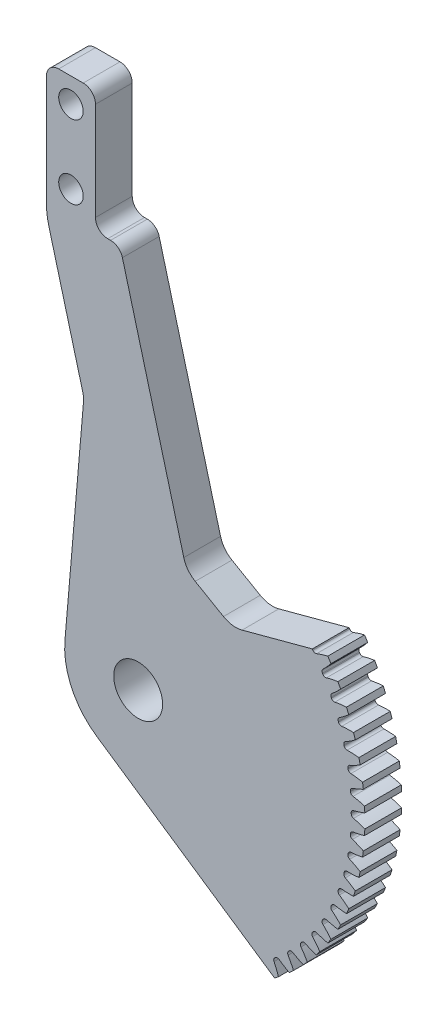
from build123d import *

# Parameters (mm, degrees)
SKETCH2_R                   = 60.325
BOSS_EXTRUDE2_DEPTH         = 4.7625
BOSS_EXTRUDE3_DEPTH         = 9.525
SKETCH4_W                   = 19.05
SKETCH4_H                   = 31.75
BOSS_EXTRUDE4_DEPTH         = 9.525
BOSS_EXTRUDE5_DEPTH         = 9.525
F_1_2_0_5_DIAMETER_HOLE1_D  = 12.6746
CUT_EXTRUDE1_DEPTH          = 143.813025258
CUT_EXTRUDE2_DEPTH          = 143.813025258
CUT_EXTRUDE3_DEPTH          = 12.7
SKETCH15_W                  = 6.35
SKETCH15_H                  = 31.75
CUT_EXTRUDE6_DEPTH          = 143.138284543
F_1_4_0_25_DIAMETER_HOLE1_D = 6.35
FILLET1_R                   = 6.35
FILLET3_R                   = 3.175
CUT_EXTRUDE4_DEPTH          = 1.5875
CUT_EXTRUDE5_DEPTH          = 1.5875
FILLET2_R                   = 0.79375


with BuildPart() as part:
    # Sketch2 → Boss-Extrude2 (new, symmetric)
    with BuildSketch(Plane.XY):
        with Locations(Location((0, 0, 0), (0, 0, 180))):
            Circle(SKETCH2_R)
    extrude(amount=BOSS_EXTRUDE2_DEPTH, both=True)

    # Sketch3 → Boss-Extrude3 (add)
    with BuildSketch(Plane.XY.offset(4.7625)):
        with BuildLine():
            Line((-14.074444457, 58.660170799), (-23.119106797, 92.415310188))
            Line((-23.119106797, 92.415310188), (-4.718219806, 97.345812997))
            Line((-4.718219806, 97.345812997), (5.263113853, 60.094968654))
            ThreePointArc((5.263113853, 60.094968654), (-4.463692191, 60.159629961), (-14.074444457, 58.660170799))
        make_face()
    extrude(amount=-BOSS_EXTRUDE3_DEPTH)



with BuildPart() as body_2:
    # Sketch4 → Boss-Extrude4 (new body)
    with BuildSketch(Plane.XY.offset(4.7625)):
        with Locations((-14.243219806, 113.220812997)):
            Rectangle(SKETCH4_W, SKETCH4_H)
    extrude(amount=-BOSS_EXTRUDE4_DEPTH)


with BuildPart() as part_1:
    add(part.part)

    add(body_2.part)  # Boss-Extrude5 merges body 2
    # Sketch5 → Boss-Extrude5 (add)
    with BuildSketch(Plane.XY.offset(4.7625)):
        with BuildLine():
            Line((-23.768219806, 97.345812997), (-4.718219806, 97.345812997))
            Line((-4.718219806, 97.345812997), (-23.119106797, 92.415310188))
            ThreePointArc((-23.119106797, 92.415310188), (-23.605244415, 94.859289036), (-23.768219806, 97.345812997))
        make_face()
    extrude(amount=-BOSS_EXTRUDE5_DEPTH)

    # 1/2 (0.5) Diameter Hole1 (through all)
    with Locations(Plane.XY.offset(4.7625)):
        with Locations((0, 0)):
            Hole(F_1_2_0_5_DIAMETER_HOLE1_D / 2)

    # Sketch8 → Cut-Extrude1 (cut, through all)
    with BuildSketch(Plane.XY.offset(4.7625)):
        with BuildLine():
            Line((24.377047427, 26.253821409), (50.357281824, 33.215204234))
            ThreePointArc((50.357281824, 33.215204234), (30.88749808, 51.817642627), (5.263113853, 60.094968654))
            Line((5.263113853, 60.094968654), (12.492235056, 33.11552103))
            Line((12.492235056, 33.11552103), (24.377047427, 26.253821409))
        make_face()
    extrude(amount=-CUT_EXTRUDE1_DEPTH, mode=Mode.SUBTRACT)

    # Sketch9 → Cut-Extrude2 (cut, through all)
    with BuildSketch(Plane.XY.offset(4.7625)):
        with BuildLine():
            Line((-14.074444457, 58.660170799), (-18.979910276, 1.632637712))
            ThreePointArc((-18.979910276, 1.632637712), (-17.194819156, -8.200042328), (-10.677837987, -15.776129941))
            Line((-10.677837987, -15.776129941), (36.723533205, -47.859040253))
            ThreePointArc((36.723533205, -47.859040253), (-54.450260661, -25.966800706), (-14.074444457, 58.660170799))
        make_face()
    extrude(amount=-CUT_EXTRUDE2_DEPTH, mode=Mode.SUBTRACT)

    # Sketch10 → Cut-Extrude3 (cut)
    with BuildSketch(Plane.XY.offset(4.7625)):
        with BuildLine():
            Line((23.419033769, -49.979481499), (23.233039333, -50.066212129))
            ThreePointArc((23.233039333, -50.066212129), (22.859764861, -50.426162423), (22.788401381, -50.939782223))
            ThreePointArc((22.788401381, -50.939782223), (23.033501885, -52.449235123), (23.176311309, -53.971775034))
            ThreePointArc((23.176311309, -53.971775034), (22.477868108, -54.266374041), (21.775681229, -54.551935009))
            ThreePointArc((21.775681229, -54.551935009), (20.800064445, -53.374355201), (19.906032292, -52.133698591))
            ThreePointArc((19.906032292, -52.133698591), (19.492386647, -51.820976148), (18.973918443, -51.830397765))
            Line((18.973918443, -51.830397765), (18.781072699, -51.900587876))
            ThreePointArc((18.781072699, -51.900587876), (18.377846913, -52.226635436), (18.261990078, -52.732081021))
            ThreePointArc((18.261990078, -52.732081021), (18.374600412, -54.257151913), (18.384168307, -55.786344762))
            ThreePointArc((18.384168307, -55.786344762), (17.662706898, -56.018949394), (16.938303774, -56.242224098))
            ThreePointArc((16.938303774, -56.242224098), (16.069032349, -54.984094731), (15.286532607, -53.670239159))
            ThreePointArc((15.286532607, -53.670239159), (14.901716566, -53.322655125), (14.384400142, -53.286853409))
            Line((14.384400142, -53.286853409), (14.186170762, -53.339968811))
            ThreePointArc((14.186170762, -53.339968811), (13.756062455, -53.629632219), (13.596594005, -54.123056843))
            ThreePointArc((13.596594005, -54.123056843), (13.575857136, -55.652139017), (13.452110683, -57.176346722))
            Line((13.452110683, -57.176346722), (12.713121824, -57.345186719))
            Line((12.713121824, -57.345186719), (13.743915485, -61.994796452))
            ThreePointArc((13.743915485, -61.994796452), (60.561026372, -19.094818269), (46.817110887, 42.899978184))
            Line((46.817110887, 42.899978184), (43.30582757, 39.68247982))
            Line((43.30582757, 39.68247982), (43.814329162, 39.120307595))
            ThreePointArc((43.814329162, 39.120307595), (43.041446698, 37.800771687), (42.181387842, 36.536326718))
            ThreePointArc((42.181387842, 36.536326718), (42.029000012, 36.040669584), (42.215180006, 35.556691222))
            Line((42.215180006, 35.556691222), (42.347094264, 35.399481931))
            ThreePointArc((42.347094264, 35.399481931), (42.791390091, 35.132088469), (43.305978949, 35.196091227))
            ThreePointArc((43.305978949, 35.196091227), (44.70056181, 35.823515292), (46.134260634, 36.355520928))
            ThreePointArc((46.134260634, 36.355520928), (46.599591824, 35.757124437), (47.057161875, 35.152772613))
            ThreePointArc((47.057161875, 35.152772613), (46.172215331, 33.905619084), (45.205225619, 32.720944779))
            ThreePointArc((45.205225619, 32.720944779), (45.010218305, 32.240455244), (45.153508334, 31.742091909))
            Line((45.153508334, 31.742091909), (45.271218927, 31.573983761))
            ThreePointArc((45.271218927, 31.573983761), (45.690519198, 31.268884879), (46.208728098, 31.287794713))
            ThreePointArc((46.208728098, 31.287794713), (47.65268776, 31.791285335), (49.127298273, 32.196311443))
            ThreePointArc((49.127298273, 32.196311443), (49.538705047, 31.559635745), (49.941861175, 30.917703804))
            ThreePointArc((49.941861175, 30.917703804), (48.951585527, 29.752424244), (47.885024334, 28.656536689))
            ThreePointArc((47.885024334, 28.656536689), (47.648881659, 28.19487157), (47.7481912, 27.685916109))
            Line((47.7481912, 27.685916109), (47.850802277, 27.508188511))
            ThreePointArc((47.850802277, 27.508188511), (48.241915865, 27.167706196), (48.759800924, 27.141379191))
            ThreePointArc((48.759800924, 27.141379191), (50.242147983, 27.517104501), (51.746447509, 27.792068588))
            ThreePointArc((51.746447509, 27.792068588), (52.100798813, 27.12195917), (52.446472754, 26.447332603))
            ThreePointArc((52.446472754, 26.447332603), (51.358404599, 25.372795493), (50.200389099, 24.374035054))
            ThreePointArc((50.200389099, 24.374035054), (49.924908252, 23.934707899), (49.979481499, 23.419033771))
            Line((49.979481499, 23.419033771), (50.066212129, 23.233039335))
            ThreePointArc((50.066212129, 23.233039335), (50.426162422, 22.859764862), (50.939782223, 22.788401383))
            ThreePointArc((50.939782223, 22.788401383), (52.449235122, 23.033501886), (53.971775034, 23.176311309))
            ThreePointArc((53.971775034, 23.176311309), (54.266374041, 22.477868108), (54.551935009, 21.775681229))
            ThreePointArc((54.551935009, 21.775681229), (53.374355201, 20.800064445), (52.133698591, 19.906032292))
            ThreePointArc((52.133698591, 19.906032292), (51.820976148, 19.492386648), (51.830397765, 18.973918444))
            Line((51.830397765, 18.973918444), (51.900587876, 18.781072699))
            ThreePointArc((51.900587876, 18.781072699), (52.226635436, 18.377846913), (52.732081021, 18.261990078))
            ThreePointArc((52.732081021, 18.261990078), (54.257151913, 18.374600412), (55.786344761, 18.384168307))
            ThreePointArc((55.786344761, 18.384168307), (56.018949394, 17.662706898), (56.242224097, 16.938303774))
            ThreePointArc((56.242224097, 16.938303774), (54.984094731, 16.069032349), (53.670239158, 15.286532607))
            ThreePointArc((53.670239158, 15.286532607), (53.322655125, 14.901716566), (53.286853409, 14.384400142))
            Line((53.286853409, 14.384400142), (53.339968811, 14.186170762))
            ThreePointArc((53.339968811, 14.186170762), (53.629632219, 13.756062455), (54.123056842, 13.596594005))
            ThreePointArc((54.123056842, 13.596594005), (55.652139016, 13.575857136), (57.176346722, 13.452110683))
            ThreePointArc((57.176346722, 13.452110683), (57.345186718, 12.713121824), (57.504475902, 11.9720156))
            ThreePointArc((57.504475902, 11.9720156), (56.1753721, 11.215705215), (54.798316797, 10.550693178))
            ThreePointArc((54.798316797, 10.550693178), (54.418516498, 10.197635423), (54.337763921, 9.685407869))
            Line((54.337763921, 9.685407869), (54.373400374, 9.483303501))
            ThreePointArc((54.373400374, 9.483303501), (54.624475117, 9.029586056), (55.102123519, 8.827719642))
            ThreePointArc((55.102123519, 8.827719642), (56.623579737, 8.67379339), (58.131202157, 8.417674375))
            ThreePointArc((58.131202157, 8.417674375), (58.234992544, 7.666782215), (58.32908392, 6.914613157))
            ThreePointArc((58.32908392, 6.914613157), (56.939120968, 6.27701979), (55.50934616, 5.734556603))
            ThreePointArc((55.50934616, 5.734556603), (55.100220105, 5.415944117), (54.975131243, 4.912703794))
            Line((54.975131243, 4.912703794), (54.993017532, 4.708262572))
            ThreePointArc((54.993017532, 4.708262572), (55.203592778, 4.234389054), (55.661829767, 3.991661001))
            ThreePointArc((55.661829767, 3.991661001), (57.164080827, 3.705716838), (58.643644045, 3.319174481))
            ThreePointArc((58.643644045, 3.319174481), (58.681594914, 2.562093766), (58.709772392, 1.804586335))
            ThreePointArc((58.709772392, 1.804586335), (57.269528744, 1.290562457), (55.797915879, 0.874776591))
            ThreePointArc((55.797915879, 0.874776591), (55.362577764, 0.593034207), (55.194104619, 0.102611078))
            Line((55.194104619, 0.102611078), (55.194104619, -0.102611077))
            ThreePointArc((55.194104619, -0.102611077), (55.362577764, -0.593034206), (55.797915879, -0.87477659))
            ThreePointArc((55.797915879, -0.87477659), (57.269528744, -1.290562456), (58.709772391, -1.804586334))
            ThreePointArc((58.709772391, -1.804586334), (58.681594914, -2.562093766), (58.643644045, -3.319174482))
            ThreePointArc((58.643644045, -3.319174482), (57.164080827, -3.705716839), (55.661829767, -3.991661001))
            ThreePointArc((55.661829767, -3.991661001), (55.203592778, -4.234389054), (54.993017532, -4.708262572))
            Line((54.993017532, -4.708262572), (54.975131243, -4.912703796))
            ThreePointArc((54.975131243, -4.912703796), (55.100220104, -5.415944117), (55.509346158, -5.734556604))
            ThreePointArc((55.509346158, -5.734556604), (56.939120967, -6.277019791), (58.329083921, -6.914613157))
            ThreePointArc((58.329083921, -6.914613157), (58.234992544, -7.666782215), (58.131202157, -8.417674373))
            ThreePointArc((58.131202157, -8.417674373), (56.623579737, -8.673793389), (55.10212352, -8.82771964))
            ThreePointArc((55.10212352, -8.82771964), (54.624475118, -9.029586055), (54.373400376, -9.483303499))
            Line((54.373400376, -9.483303499), (54.337763922, -9.685407871))
            ThreePointArc((54.337763922, -9.685407871), (54.418516499, -10.197635424), (54.798316797, -10.550693179))
            ThreePointArc((54.798316797, -10.550693179), (56.175372099, -11.215705215), (57.504475901, -11.9720156))
            ThreePointArc((57.504475901, -11.9720156), (57.345186717, -12.713121823), (57.176346721, -13.452110683))
            ThreePointArc((57.176346721, -13.452110683), (55.652139016, -13.575857136), (54.123056842, -13.596594005))
            ThreePointArc((54.123056842, -13.596594005), (53.629632219, -13.756062456), (53.339968811, -14.186170763))
            Line((53.339968811, -14.186170763), (53.286853409, -14.384400143))
            ThreePointArc((53.286853409, -14.384400143), (53.322655125, -14.901716567), (53.670239157, -15.286532608))
            ThreePointArc((53.670239157, -15.286532608), (54.98409473, -16.06903235), (56.242224097, -16.938303774))
            ThreePointArc((56.242224097, -16.938303774), (56.018949394, -17.662706898), (55.786344761, -18.384168307))
            ThreePointArc((55.786344761, -18.384168307), (54.257151913, -18.374600413), (52.732081021, -18.261990079))
            ThreePointArc((52.732081021, -18.261990079), (52.226635436, -18.377846914), (51.900587876, -18.7810727))
            Line((51.900587876, -18.7810727), (51.830397765, -18.973918446))
            ThreePointArc((51.830397765, -18.973918446), (51.820976147, -19.49238665), (52.133698591, -19.906032294))
            ThreePointArc((52.133698591, -19.906032294), (53.3743552, -20.800064446), (54.551935009, -21.77568123))
            ThreePointArc((54.551935009, -21.77568123), (54.26637404, -22.477868109), (53.971775034, -23.17631131))
            ThreePointArc((53.971775034, -23.17631131), (52.449235122, -23.033501886), (50.939782222, -22.788401382))
            ThreePointArc((50.939782222, -22.788401382), (50.426162422, -22.859764862), (50.066212128, -23.233039334))
            Line((50.066212128, -23.233039334), (49.979481498, -23.419033771))
            ThreePointArc((49.979481498, -23.419033771), (49.924908251, -23.934707899), (50.200389098, -24.374035054))
            ThreePointArc((50.200389098, -24.374035054), (51.358404598, -25.372795492), (52.446472755, -26.447332602))
            ThreePointArc((52.446472755, -26.447332602), (52.100798813, -27.12195917), (51.746447509, -27.792068588))
            ThreePointArc((51.746447509, -27.792068588), (50.242147983, -27.5171045), (48.759800924, -27.141379189))
            ThreePointArc((48.759800924, -27.141379189), (48.241915865, -27.167706193), (47.850802277, -27.508188509))
            Line((47.850802277, -27.508188509), (47.748191198, -27.685916109))
            ThreePointArc((47.748191198, -27.685916109), (47.648881658, -28.19487157), (47.885024332, -28.65653669))
            ThreePointArc((47.885024332, -28.65653669), (48.951585526, -29.752424244), (49.941861175, -30.917703804))
            ThreePointArc((49.941861175, -30.917703804), (49.538705047, -31.559635745), (49.127298272, -32.196311444))
            ThreePointArc((49.127298272, -32.196311444), (47.652687759, -31.791285335), (46.208728097, -31.287794714))
            ThreePointArc((46.208728097, -31.287794714), (45.690519197, -31.268884879), (45.271218925, -31.573983761))
            Line((45.271218925, -31.573983761), (45.153508334, -31.742091908))
            ThreePointArc((45.153508334, -31.742091908), (45.010218305, -32.240455243), (45.205225619, -32.720944778))
            ThreePointArc((45.205225619, -32.720944778), (46.172215331, -33.905619083), (47.057161876, -35.152772612))
            ThreePointArc((47.057161876, -35.152772612), (46.599591825, -35.757124436), (46.134260634, -36.355520928))
            ThreePointArc((46.134260634, -36.355520928), (44.700561811, -35.823515291), (43.30597895, -35.196091226))
            ThreePointArc((43.30597895, -35.196091226), (42.791390092, -35.132088468), (42.347094265, -35.39948193))
            Line((42.347094265, -35.39948193), (42.215180006, -35.556691222))
            ThreePointArc((42.215180006, -35.556691222), (42.029000012, -36.040669585), (42.181387842, -36.536326719))
            ThreePointArc((42.181387842, -36.536326719), (43.041446698, -37.800771687), (43.814329162, -39.120307595))
            ThreePointArc((43.814329162, -39.120307595), (43.305827571, -39.68247982), (42.790113415, -40.238042947))
            ThreePointArc((42.790113415, -40.238042947), (41.408237595, -39.583106666), (40.073645153, -38.836524235))
            ThreePointArc((40.073645153, -38.836524235), (39.566592669, -38.727915652), (39.100682646, -38.955568668))
            Line((39.100682646, -38.955568668), (38.955568668, -39.100682646))
            ThreePointArc((38.955568668, -39.100682646), (38.727915652, -39.566592669), (38.836524235, -40.073645153))
            ThreePointArc((38.836524235, -40.073645153), (39.583106666, -41.408237595), (40.238042947, -42.790113415))
            ThreePointArc((40.238042947, -42.790113415), (39.68247982, -43.305827571), (39.120307595, -43.814329163))
            ThreePointArc((39.120307595, -43.814329163), (37.800771687, -43.041446699), (36.536326719, -42.181387843))
            ThreePointArc((36.536326719, -42.181387843), (36.040669585, -42.029000013), (35.556691222, -42.215180007))
            Line((35.556691222, -42.215180007), (35.39948193, -42.347094266))
            ThreePointArc((35.39948193, -42.347094266), (35.132088468, -42.791390093), (35.196091226, -43.305978951))
            ThreePointArc((35.196091226, -43.305978951), (35.823515291, -44.700561812), (36.355520929, -46.134260635))
            ThreePointArc((36.355520929, -46.134260635), (35.757124436, -46.599591826), (35.152772612, -47.057161878))
            ThreePointArc((35.152772612, -47.057161878), (33.905619082, -46.172215333), (32.720944776, -45.20522562))
            ThreePointArc((32.720944776, -45.20522562), (32.240455241, -45.010218306), (31.742091907, -45.153508335))
            Line((31.742091907, -45.153508335), (31.57398376, -45.271218926))
            ThreePointArc((31.57398376, -45.271218926), (31.268884878, -45.690519198), (31.287794713, -46.208728098))
            ThreePointArc((31.287794713, -46.208728098), (31.791285334, -47.65268776), (32.196311443, -49.127298273))
            ThreePointArc((32.196311443, -49.127298273), (31.559635745, -49.538705048), (30.917703804, -49.941861175))
            ThreePointArc((30.917703804, -49.941861175), (29.752424244, -48.951585527), (28.656536689, -47.885024334))
            ThreePointArc((28.656536689, -47.885024334), (28.194871569, -47.64888166), (27.685916109, -47.7481912))
            Line((27.685916109, -47.7481912), (27.508188507, -47.850802279))
            ThreePointArc((27.508188507, -47.850802279), (27.167706192, -48.241915867), (27.141379187, -48.759800926))
            ThreePointArc((27.141379187, -48.759800926), (27.517104499, -50.242147984), (27.792068588, -51.74644751))
            ThreePointArc((27.792068588, -51.74644751), (27.121959169, -52.100798815), (26.447332602, -52.446472756))
            ThreePointArc((26.447332602, -52.446472756), (25.372795491, -51.3584046), (24.374035052, -50.2003891))
            ThreePointArc((24.374035052, -50.2003891), (23.934707897, -49.924908253), (23.419033769, -49.979481499))
        make_face()
    extrude(amount=-CUT_EXTRUDE3_DEPTH, mode=Mode.SUBTRACT)

    # Sketch15 → Cut-Extrude6 (cut, through all)
    with BuildSketch(Plane.XY.offset(4.7625)):
        with Locations((-7.893219806, 113.220812997)):
            Rectangle(SKETCH15_W, SKETCH15_H)
    extrude(amount=-CUT_EXTRUDE6_DEPTH, mode=Mode.SUBTRACT)

    # 1/4 (0.25) Diameter Hole1 (through all)
    with Locations(Plane.XY.offset(4.7625)):
        with Locations((-17.418219806, 122.745812997), (-17.418219806, 103.695812997)):
            Hole(F_1_4_0_25_DIAMETER_HOLE1_D / 2)

    # Fillet1
    fillet1_edges = [part_1.edges().sort_by_distance(p)[0] for p in [
        (24.377047427, 26.253821409, 0),
        (12.492235056, 33.11552103, 0),
        (-14.074444457, 58.660170799, 0),
    ]]
    fillet(fillet1_edges, radius=FILLET1_R)

    # Fillet3
    fillet3_edges = [part_1.edges().sort_by_distance(p)[0] for p in [
        (-23.768219806, 129.095812997, 0),
        (-11.068219806, 97.345812997, 0),
        (-11.068219806, 129.095812997, 0),
        (-4.718219806, 97.345812997, 0),
    ]]
    fillet(fillet3_edges, radius=FILLET3_R)

    # Sketch13 → Cut-Extrude4 (cut)
    with BuildSketch(Plane.XY.offset(-4.7625)):
        with BuildLine():
            Line((25.4, 1.6002), (50.8, 1.6002))
            ThreePointArc((50.8, 1.6002), (52.4002, 0), (50.8, -1.6002))
            Line((50.8, -1.6002), (25.4, -1.6002))
            ThreePointArc((25.4, -1.6002), (23.7998, 0), (25.4, 1.6002))
        make_face()
    extrude(amount=CUT_EXTRUDE4_DEPTH, mode=Mode.SUBTRACT)

    # Sketch14 → Cut-Extrude5 (cut)
    with BuildSketch(Plane.XY.offset(-4.7625)):
        with BuildLine():
            Line((42.007692308, 25.4), (38.107632212, 25.4))
            add(Edge.make_bspline(
                [(38.107632212, 25.4), (37.857033272, 25.399394073), (37.377431834, 25.398234436), (36.689241774, 25.386065636), (36.06438351, 25.369949139), (35.502384783, 25.33628411), (35.001740632, 25.306568481), (34.56461642, 25.257694596), (34.188954131, 25.214104381), (33.963094337, 25.166146393), (33.86030649, 25.144320913)],
                knots=[0, 0, 0, 0, 1.411347063, 2.701065231, 3.876524531, 4.931206492, 5.871916627, 6.700262025, 7.408494688, 8, 8, 8, 8], degree=3))
            add(Edge.make_bspline(
                [(33.86030649, 25.144320913), (33.70704198, 25.105792151), (33.405087549, 25.029884619), (32.97006223, 24.880438779), (32.559359388, 24.704252854), (32.173520335, 24.502295876), (31.811617359, 24.273553444), (31.48065207, 24.011124929), (31.167586413, 23.728415425), (30.884499987, 23.416555233), (30.626934154, 23.08492874), (30.406708625, 22.733594394), (30.217753179, 22.367270624), (30.060048587, 21.986501977), (29.94213026, 21.58704233), (29.859535305, 21.171831644), (29.802692742, 20.742103075), (29.798347369, 20.449425053), (29.796153846, 20.301682692)],
                knots=[0, 0, 0, 0, 1.103820101, 2.174693741, 3.209859002, 4.223626675, 5.214778413, 6.196198804, 7.171320727, 8.158999421, 9.134971582, 10.10159085, 11.051641808, 12.012235658, 12.97676874, 13.956376421, 14.968389326, 16, 16, 16, 16], degree=3))
            add(Edge.make_bspline(
                [(29.796153846, 20.301682692), (29.804319524, 20.058022605), (29.820367838, 19.579148216), (29.966215205, 18.880745757), (30.20521803, 18.222399152), (30.477825526, 17.708114557), (30.743023603, 17.325775399), (30.965052556, 17.053961588), (31.209149276, 16.799314001), (31.473582968, 16.559181508), (31.765312609, 16.344175735), (32.075438564, 16.140316614), (32.407619191, 15.952912587), (32.886439767, 15.727887575), (33.534072655, 15.49334805), (34.370863838, 15.292276936), (35.275080079, 15.170140178), (35.900263727, 15.151773606), (36.222475962, 15.142307692)],
                knots=[0, 0, 0, 0, 1.258986715, 2.474334223, 3.670931197, 4.871716255, 5.472099774, 6.075216246, 6.684756624, 7.295006596, 7.919971941, 8.55677058, 9.213641309, 9.890468445, 11.291088691, 12.766994829, 14.333747493, 16, 16, 16, 16], degree=3))
            Line((36.222475962, 15.142307692), (29.551923077, 6.35))
            Line((29.551923077, 6.35), (32.242277644, 6.35))
            Line((32.242277644, 6.35), (38.912830529, 15.142307692))
            Line((38.912830529, 15.142307692), (39.565384615, 15.142307692))
            Line((39.565384615, 15.142307692), (39.565384615, 6.35))
            Line((39.565384615, 6.35), (42.007692308, 6.35))
            Line((42.007692308, 6.35), (42.007692308, 25.4))
        make_face()
        with BuildLine():
            Line((39.565384615, 23.201923077), (39.565384615, 17.33656851))
            Line((39.565384615, 17.33656851), (36.764362981, 17.317487981))
            add(Edge.make_bspline(
                [(36.764362981, 17.317487981), (36.614248757, 17.317875845), (36.324110083, 17.318625503), (35.904139381, 17.334061958), (35.514606415, 17.359910747), (35.157049873, 17.398194341), (34.832506846, 17.443867956), (34.53848961, 17.49502279), (34.277758928, 17.564098146), (33.973192748, 17.663667763), (33.634815888, 17.823635769), (33.27586075, 18.067193704), (32.961223901, 18.355438548), (32.703205389, 18.693186513), (32.496762992, 19.063733222), (32.346580868, 19.459365589), (32.256112285, 19.87785357), (32.24441209, 20.163857436), (32.238461538, 20.309314904)],
                knots=[0, 0, 0, 0, 1.165824803, 2.253289887, 3.263370799, 4.197285623, 5.045371766, 5.808848116, 6.513348392, 7.138183875, 8.296069948, 9.40583476, 10.496436725, 11.595152671, 12.691956992, 13.780050175, 14.870965332, 16, 16, 16, 16], degree=3))
            add(Edge.make_bspline(
                [(32.238461538, 20.309314904), (32.2446936, 20.449629298), (32.257054659, 20.727937623), (32.344971818, 21.136390579), (32.502121069, 21.521726263), (32.710622356, 21.883449352), (32.968965533, 22.208634959), (33.266066086, 22.49517958), (33.609278845, 22.722306075), (33.925258141, 22.875601192), (34.208444957, 22.971742136), (34.459195027, 23.031114739), (34.744605907, 23.083539222), (35.065260751, 23.129615925), (35.420566945, 23.163280044), (35.81141078, 23.184459154), (36.237599385, 23.2010999), (36.534105791, 23.201641762), (36.688040865, 23.201923077)],
                knots=[0, 0, 0, 0, 1.114111647, 2.20979856, 3.297775031, 4.406653707, 5.514151176, 6.585969385, 7.670234779, 8.768154562, 9.365517569, 10.041721951, 10.812428959, 11.669578816, 12.61341719, 13.645562296, 14.777663698, 16, 16, 16, 16], degree=3))
            Line((36.688040865, 23.201923077), (39.565384615, 23.201923077))
        make_face(mode=Mode.SUBTRACT)
    extrude(amount=CUT_EXTRUDE5_DEPTH, mode=Mode.SUBTRACT)

    # Fillet2
    fillet2_edges = [part_1.edges().sort_by_distance(p)[0] for p in [
        (36.222475962, 15.142307692, -3.96875),
        (29.796153846, 20.301682692, -3.96875),
        (33.86030649, 25.144320913, -3.96875),
        (38.107632212, 25.4, -3.96875),
        (29.551923077, 6.35, -3.96875),
        (39.565384615, 23.201923077, -3.96875),
        (39.565384615, 17.33656851, -3.96875),
        (42.007692308, 25.4, -3.96875),
        (32.242277644, 6.35, -3.96875),
        (38.912830529, 15.142307692, -3.96875),
        (39.565384615, 6.35, -3.96875),
        (42.007692308, 6.35, -3.96875),
    ]]
    fillet(fillet2_edges, radius=FILLET2_R)


solid = part_1.part
